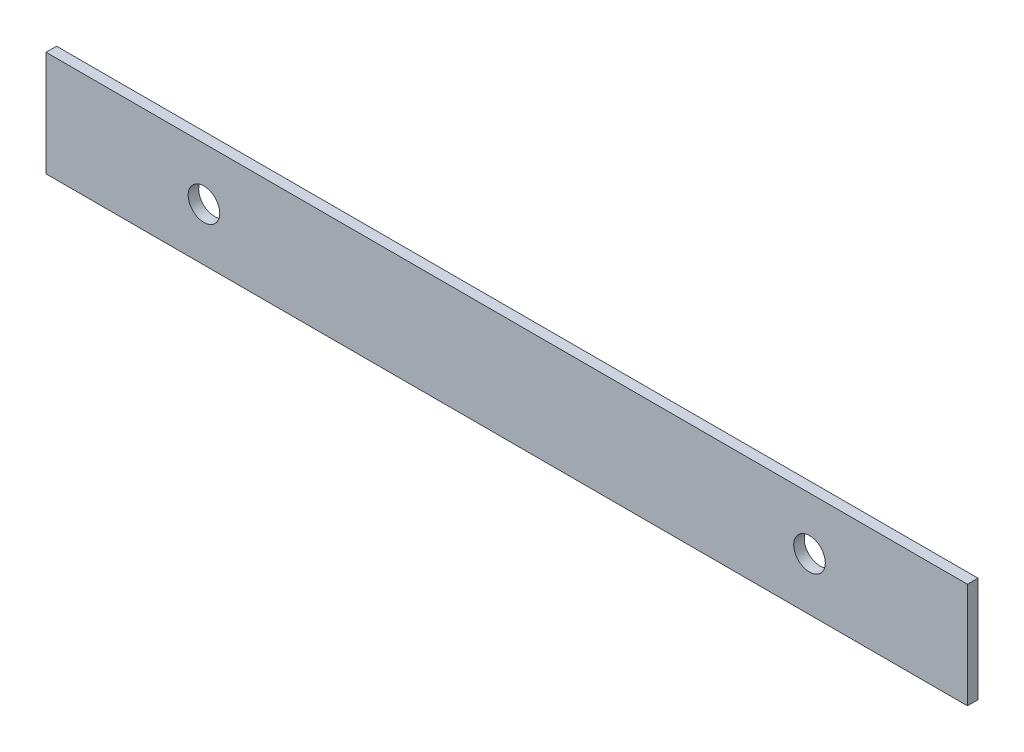
from build123d import *

# Parameters (mm, degrees)
SKETCH_1_W          = 350
SKETCH_1_H          = 40
EXTRUDE_1_DEPTH     = 4
SKETCH_2_R          = 6
CUT_EXTRUDE_1_DEPTH = 353.301007662
SKETCH_3_R          = 6
CUT_EXTRUDE_2_DEPTH = 353.301007662


with BuildPart() as part:
    # Эскиз1 → Бобышка-Вытянуть1 (new body)
    with BuildSketch(Plane.XY):
        with Locations((175, 20)):
            Rectangle(SKETCH_1_W, SKETCH_1_H)
    extrude(amount=EXTRUDE_1_DEPTH)

    # Эскиз2 → Вырез-Вытянуть1 (cut, through all)
    with BuildSketch(Plane.XY.offset(4)):
        with Locations((60, 20)):
            Circle(SKETCH_2_R)
    extrude(amount=-CUT_EXTRUDE_1_DEPTH, mode=Mode.SUBTRACT)

    # Эскиз3 → Вырез-Вытянуть2 (cut, through all)
    with BuildSketch(Plane.XY.offset(4)):
        with Locations((290, 20)):
            Circle(SKETCH_3_R)
    extrude(amount=-CUT_EXTRUDE_2_DEPTH, mode=Mode.SUBTRACT)


solid = part.part
